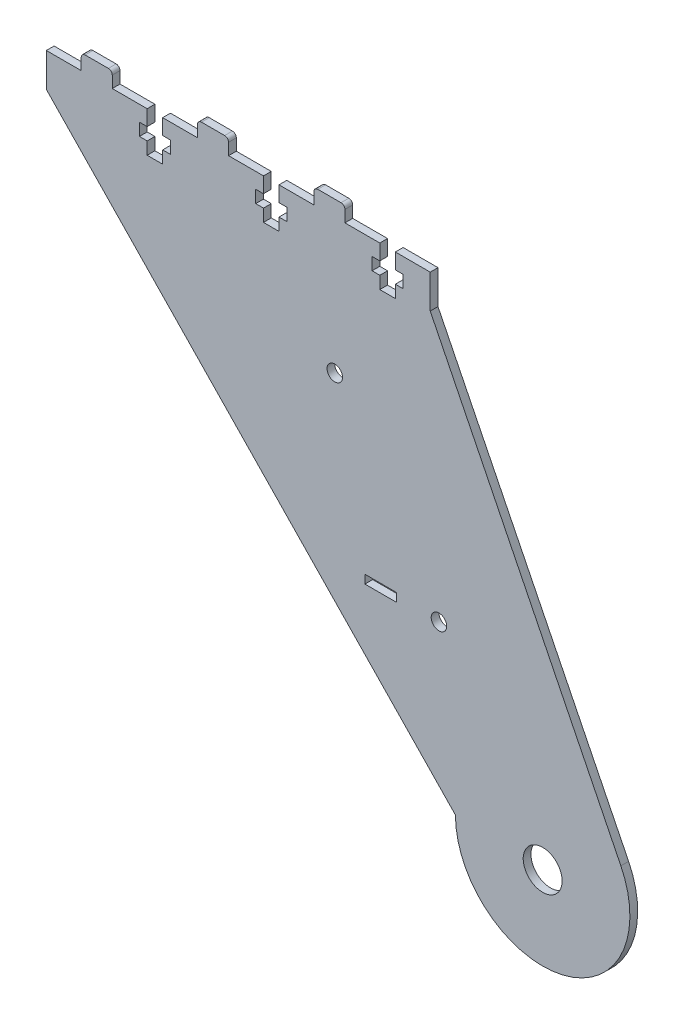
from build123d import *

# Parameters (mm, degrees)
SKETCH_1_R      = 2
SKETCH_1_R_2    = 5.02
SKETCH_1_W      = 8.2
SKETCH_1_H      = 2.2
EXTRUDE_1_DEPTH = 2
FILLET_1_R      = 1


with BuildPart() as part:
    # 草图1 → 凸台-拉伸1 (new body)
    with BuildSketch(Plane.XY):
        with BuildLine():
            Line((-38.15, 66.25), (-38.15, 62.25))
            Line((-38.15, 62.25), (-40.15, 62.25))
            Line((-40.15, 62.25), (-40.15, 59.05))
            Line((-40.15, 59.05), (-38.15, 59.05))
            Line((-38.15, 59.05), (-38.15, 55.85))
            Line((-38.15, 55.85), (-34.15, 55.85))
            Line((-34.15, 55.85), (-34.15, 59.05))
            Line((-34.15, 59.05), (-32.15, 59.05))
            Line((-32.15, 59.05), (-32.15, 62.25))
            Line((-32.15, 62.25), (-34.15, 62.25))
            Line((-34.15, 62.25), (-34.15, 66.25))
            Line((-34.15, 66.25), (-25.15, 66.25))
            Line((-25.15, 66.25), (-25.15, 70.25))
            Line((-25.15, 70.25), (-17.15, 70.25))
            Line((-17.15, 70.25), (-17.15, 66.25))
            Line((-17.15, 66.25), (-8.15, 66.25))
            Line((-8.15, 66.25), (-8.15, 62.25))
            Line((-8.15, 62.25), (-10.15, 62.25))
            Line((-10.15, 62.25), (-10.15, 59.05))
            Line((-10.15, 59.05), (-8.15, 59.05))
            Line((-8.15, 59.05), (-8.15, 55.85))
            Line((-8.15, 55.85), (-4.15, 55.85))
            Line((-4.15, 55.85), (-4.15, 59.05))
            Line((-4.15, 59.05), (-2.15, 59.05))
            Line((-2.15, 59.05), (-2.15, 62.25))
            Line((-2.15, 62.25), (-4.15, 62.25))
            Line((-4.15, 62.25), (-4.15, 66.25))
            Line((-4.15, 66.25), (4.85, 66.25))
            Line((4.85, 66.25), (4.85, 57.55))
            Line((4.85, 57.55), (54.01460577, -41.768082641))
            ThreePointArc((54.01460577, -41.768082641), (38.975737517, -73.658373169), (11.35, -51.75))
            Line((11.35, -51.75), (-94.15, 57.55))
            Line((-94.15, 57.55), (-94.15, 66.25))
            Line((-94.15, 66.25), (-85.15, 66.25))
            Line((-85.15, 66.25), (-85.15, 70.25))
            Line((-85.15, 70.25), (-77.15, 70.25))
            Line((-77.15, 70.25), (-77.15, 66.25))
            Line((-77.15, 66.25), (-68.15, 66.25))
            Line((-68.15, 66.25), (-68.15, 62.25))
            Line((-68.15, 62.25), (-70.15, 62.25))
            Line((-70.15, 62.25), (-70.15, 59.05))
            Line((-70.15, 59.05), (-68.15, 59.05))
            Line((-68.15, 59.05), (-68.15, 55.85))
            Line((-68.15, 55.85), (-64.15, 55.85))
            Line((-64.15, 55.85), (-64.15, 59.05))
            Line((-64.15, 59.05), (-62.15, 59.05))
            Line((-62.15, 59.05), (-62.15, 62.25))
            Line((-62.15, 62.25), (-64.15, 62.25))
            Line((-64.15, 62.25), (-64.15, 66.25))
            Line((-64.15, 66.25), (-55.15, 66.25))
            Line((-55.15, 66.25), (-55.15, 70.25))
            Line((-55.15, 70.25), (-47.15, 70.25))
            Line((-47.15, 70.25), (-47.15, 66.25))
            Line((-47.15, 66.25), (-38.15, 66.25))
        make_face()
        with Locations((-19.762745434, 31.422010331)):
            Circle(SKETCH_1_R, mode=Mode.SUBTRACT)
        with Locations((7.098407643, -10.75)):
            Circle(SKETCH_1_R, mode=Mode.SUBTRACT)
        with Locations((33.85, -52.75)):
            Circle(SKETCH_1_R_2, mode=Mode.SUBTRACT)
        with Locations((-7.901592357, -10.75)):
            Rectangle(SKETCH_1_W, SKETCH_1_H, mode=Mode.SUBTRACT)
    extrude(amount=EXTRUDE_1_DEPTH)

    # 圆角1
    fillet_1_edges = [part.edges().sort_by_distance(p)[0] for p in [
        (-25.15, 70.25, 1),
        (-17.15, 70.25, 1),
        (-85.15, 70.25, 1),
        (-77.15, 70.25, 1),
        (-55.15, 70.25, 1),
        (-47.15, 70.25, 1),
    ]]
    fillet(fillet_1_edges, radius=FILLET_1_R)


solid = part.part
